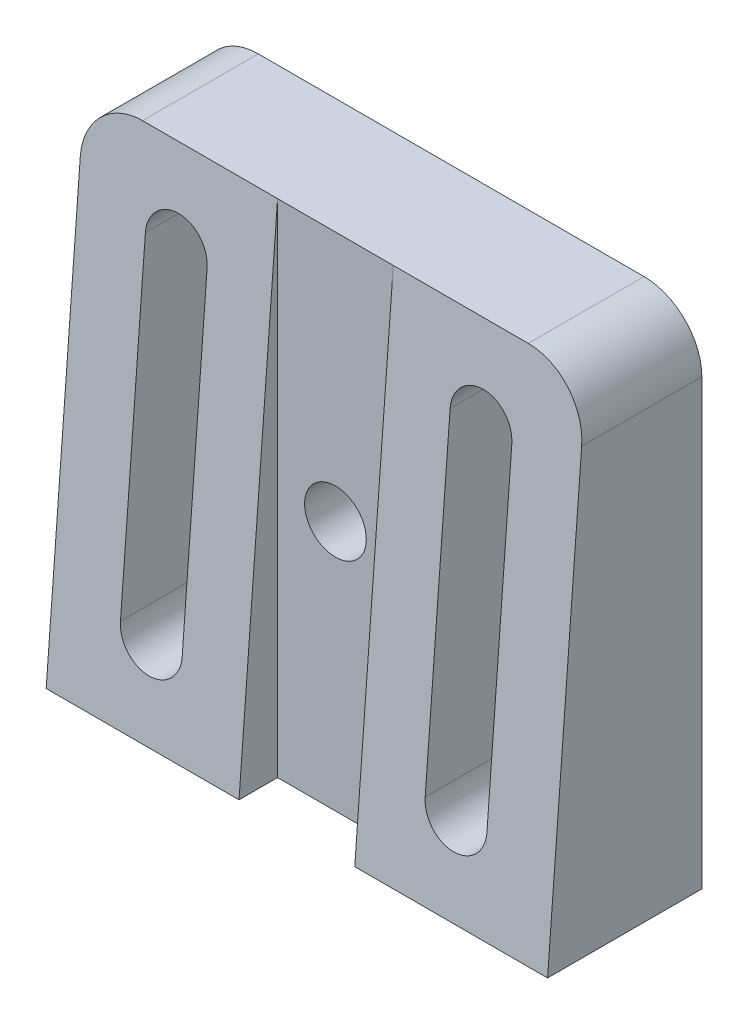
from build123d import *

# Parameters (mm, degrees)
SKETCH_1_W               = 26
SKETCH_1_H               = 26
EXTRUDE_1_DEPTH          = 8
CUT_EXTRUDE_1_DEPTH      = 21.049937656
CUT_EXTRUDE_1_DEPTH_BACK = 21.049937656
SKETCH_2_OUTSIDE_W       = 17.526
SKETCH_2_OUTSIDE_H       = 35.526
HOLE_WIZARD_M3_1_D       = 3.2
SKETCH_4_OUTSIDE_W       = 17.526
SKETCH_4_OUTSIDE_H       = 35.526
SKETCH_4_OUTSIDE_W_2     = 6
SKETCH_4_OUTSIDE_H_2     = 26
CUT_EXTRUDE_2_DEPTH      = 3
FILLET_1_R               = 3


with BuildPart() as part:
    # ｽｹｯﾁ1 → ﾎﾞｽ - 押し出し1 (new body)
    with BuildSketch(Plane.XY):
        Rectangle(SKETCH_1_W, SKETCH_1_H)
        with BuildLine():
            Line((-6.3, 8.4), (-6.3, -8.4))
            ThreePointArc((-6.3, -8.4), (-7.9, -10), (-9.5, -8.4))
            Line((-9.5, -8.4), (-9.5, 8.4))
            ThreePointArc((-9.5, 8.4), (-7.9, 10), (-6.3, 8.4))
        make_face(mode=Mode.SUBTRACT)
        with BuildLine():
            Line((9.5, 8.4), (9.5, -8.4))
            ThreePointArc((9.5, -8.4), (7.9, -10), (6.3, -8.4))
            Line((6.3, -8.4), (6.3, 8.4))
            ThreePointArc((6.3, 8.4), (7.9, 10), (9.5, 8.4))
        make_face(mode=Mode.SUBTRACT)
    extrude(amount=EXTRUDE_1_DEPTH)

    # ｽｹｯﾁ2 outside → ｶｯﾄ - 押し出し1 (cut, two sides: drawn at the far end of the back side and taken through both)
    with BuildSketch(Plane(origin=(0, 0, 0), x_dir=(0, 0, -1), z_dir=(1, 0, 0)).offset(-CUT_EXTRUDE_1_DEPTH_BACK)):
        with Locations((-4, 0)):
            Rectangle(SKETCH_2_OUTSIDE_W, SKETCH_2_OUTSIDE_H)
        Polygon((0, -13), (-8, -13), (-6, 13), (0, 13), align=None, mode=Mode.SUBTRACT)
    extrude(amount=CUT_EXTRUDE_1_DEPTH + CUT_EXTRUDE_1_DEPTH_BACK, mode=Mode.SUBTRACT)

    # M3 すきま穴1 (through all)
    with Locations(Plane(origin=(0, 0, 0), x_dir=(-1, 0, 0), z_dir=(0, 0, -1))):
        with Locations((0, 0)):
            Hole(HOLE_WIZARD_M3_1_D / 2)

    # ｽｹｯﾁ4 outside → ｶｯﾄ - 押し出し2 (cut, symmetric)
    with BuildSketch(Plane(origin=(0, 0, 0), x_dir=(0, 0, -1), z_dir=(1, 0, 0))):
        with Locations((-4, 0)):
            Rectangle(SKETCH_4_OUTSIDE_W, SKETCH_4_OUTSIDE_H)
        with Locations((-3, 0)):
            Rectangle(SKETCH_4_OUTSIDE_W_2, SKETCH_4_OUTSIDE_H_2, mode=Mode.SUBTRACT)
    extrude(amount=CUT_EXTRUDE_2_DEPTH, both=True, mode=Mode.SUBTRACT)

    # ﾌｨﾚｯﾄ1
    fillet_1_edges = [part.edges().sort_by_distance(p)[0] for p in [
        (-13, 13, 3),
        (13, 13, 3),
    ]]
    fillet(fillet_1_edges, radius=FILLET_1_R)


solid = part.part
